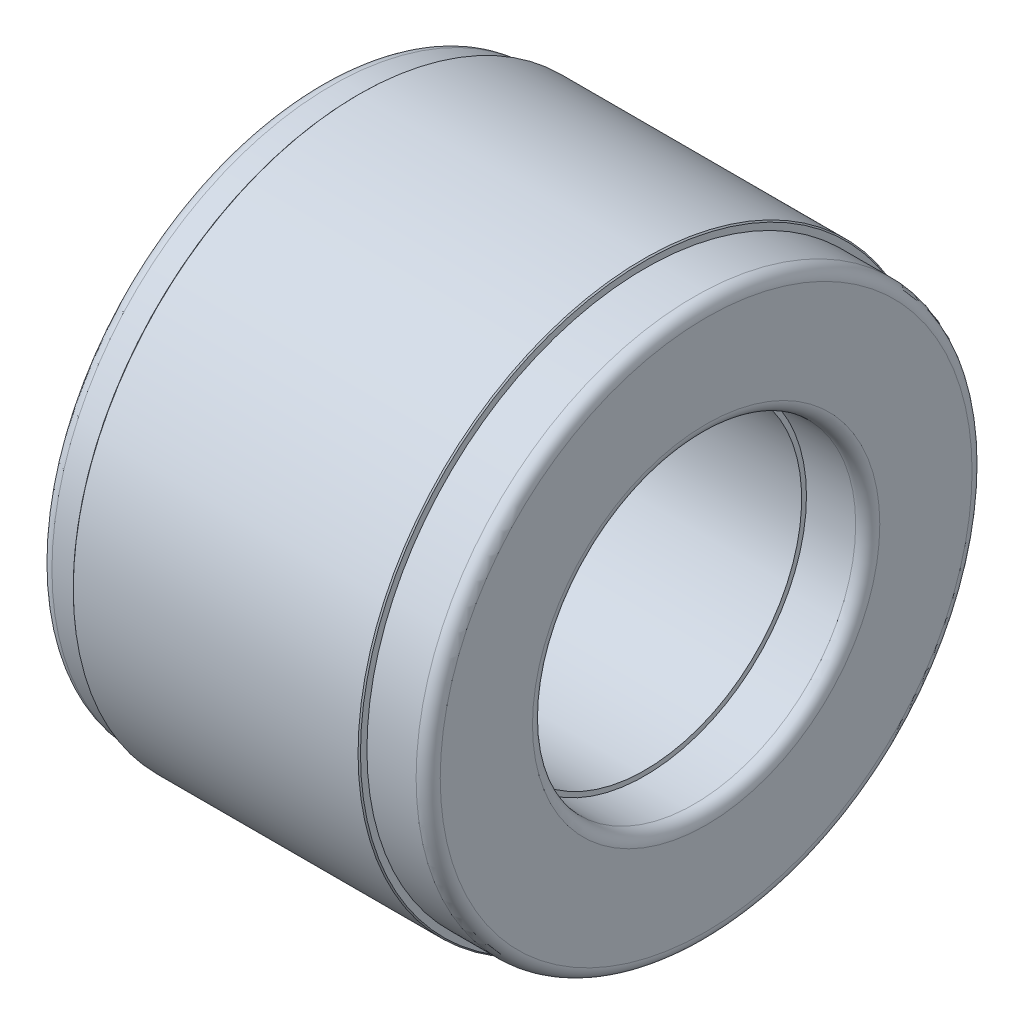
from build123d import *

# Parameters (mm, degrees)
FILLET1_R     = 2
CHAMFER1_SIZE = 0.2


with BuildPart() as part:
    # Sketch1 → Revolve1 (revolve)
    with BuildSketch(Plane.XY, mode=Mode.PRIVATE) as revolve1_sk:
        Polygon((0, 46.355), (0, 27.305), (6.35, 27.305), (6.35, 26), (53.98, 26), (53.98, 26.8), (64.14, 26.8), (64.14, 46.1), (53.98, 46.1), (53.98, 47.37), (6.35, 47.37), (6.35, 46.355), align=None)
    revolve(revolve1_sk.sketch.rotate(Axis((0, 0, 0), (1, 0, 0)), 90), axis=Axis((0, 0, 0), (1, 0, 0)))

    # Fillet1
    fillet1_edges = [part.edges().sort_by_distance(p)[0] for p in [
        (64.14, 0, -46.1),
        (64.14, 0, -26.8),
        (0, 0, -27.305),
        (0, 0, -46.355),
    ]]
    fillet(fillet1_edges, radius=FILLET1_R)

    # Chamfer1
    chamfer1_edges = [part.edges().sort_by_distance(p)[0] for p in [
        (53.98, 0, -47.37),
        (6.35, 0, -47.37),
    ]]
    chamfer(chamfer1_edges, length=CHAMFER1_SIZE)


solid = part.part
